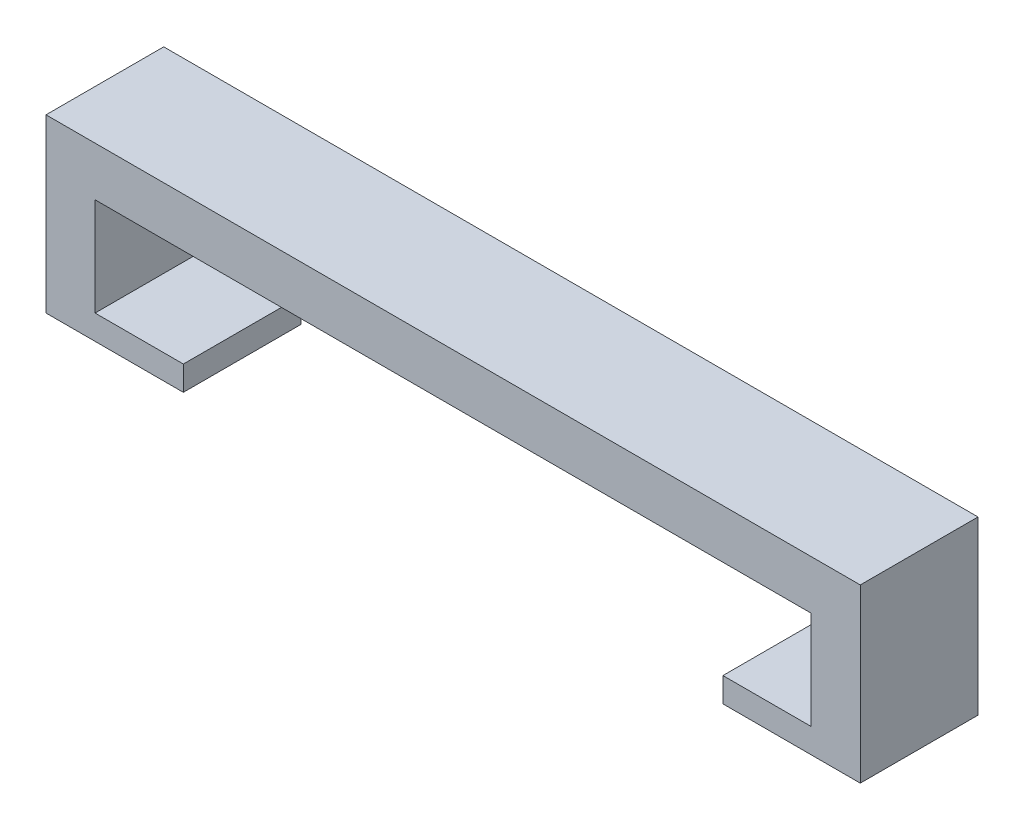
from build123d import *

# Parameters (mm, degrees)
Y_KSEKLIK_EKSTR_ZYON1_DEPTH = 2.4


with BuildPart() as part:
    # Çizim1 → Yükseklik-Ekstrüzyon1 (new body)
    with BuildSketch(Plane.XY):
        Polygon((4.205184962, -0.805698091), (4.205184962, -0.305698091), (6.005184962, -0.305698091), (6.005184962, 1.694301909), (-8.594815038, 1.694301909), (-8.594815038, -0.305698091), (-6.794815038, -0.305698091), (-6.794815038, -0.805698091), (-9.594815038, -0.805698091), (-9.594815038, 2.694301909), (7.005184962, 2.694301909), (7.005184962, -0.805698091), align=None)
    extrude(amount=Y_KSEKLIK_EKSTR_ZYON1_DEPTH)


solid = part.part
